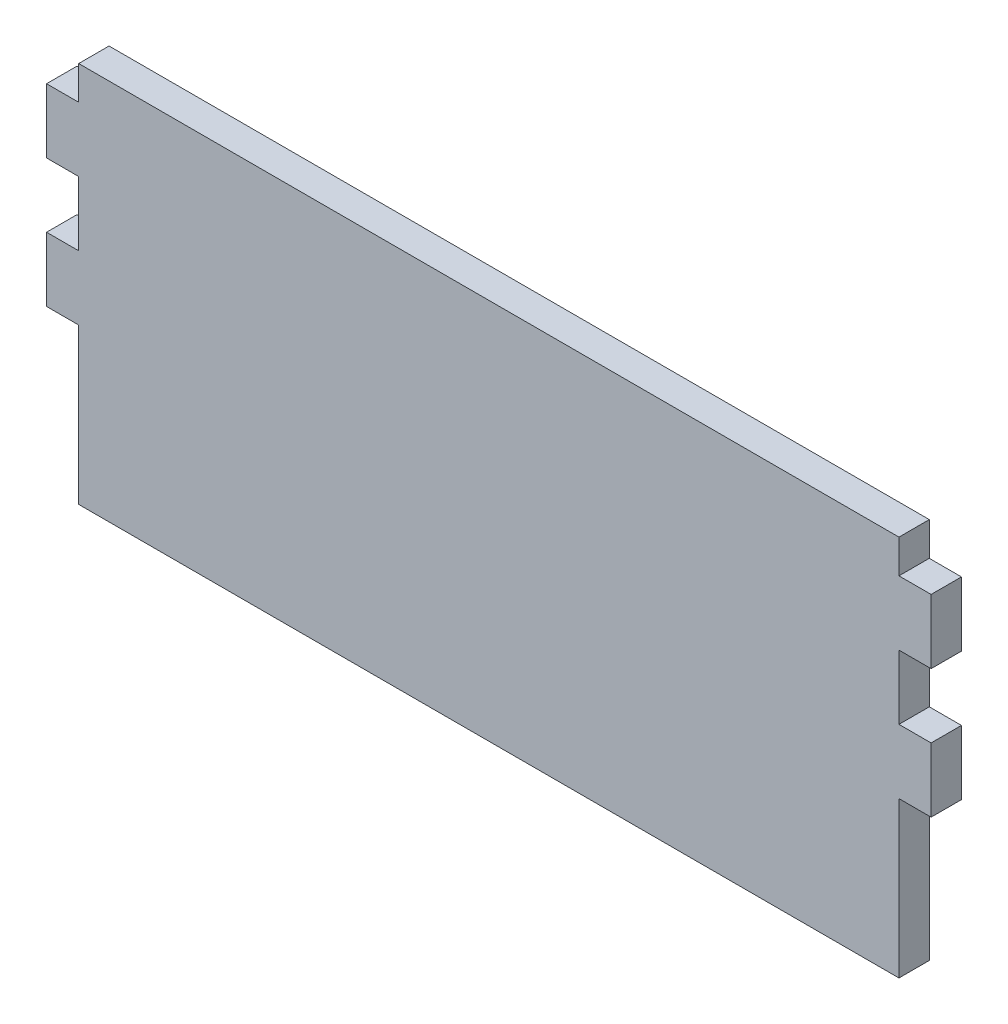
from build123d import *

# Parameters (mm, degrees)
BOSS_EXTRUDE1_DEPTH = 2.9972


with BuildPart() as part:
    # Sketch1 → Boss-Extrude1 (new body)
    with BuildSketch(Plane.XY):
        Polygon((0, 0), (0, 15.3413028), (-3.175, 15.3413028), (-3.175, 21.6913028), (0, 21.6913028), (0, 28.0413028), (-3.175, 28.0413028), (-3.175, 34.3913028), (0, 34.3913028), (0, 37.705820936), (81, 37.705820936), (81, 34.3913028), (84.175, 34.3913028), (84.175, 28.0413028), (81, 28.0413028), (81, 21.6913028), (84.175, 21.6913028), (84.175, 15.3413028), (81, 15.3413028), (81, 0), align=None)
    extrude(amount=BOSS_EXTRUDE1_DEPTH)


solid = part.part
